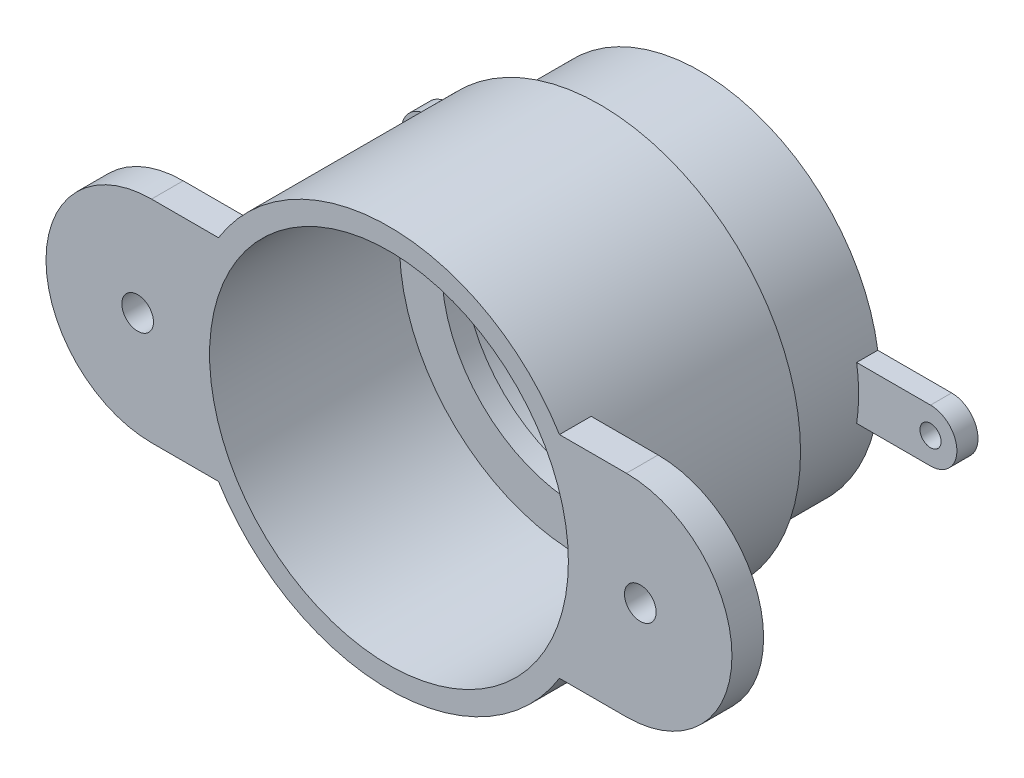
from build123d import *

# Parameters (mm, degrees)
SKETCH_1_R          = 19
EXTRUDE_1_DEPTH     = 20
EXTRUDE_2_DEPTH     = 3
SKETCH_6_R          = 17
CUT_EXTRUDE_1_DEPTH = 18
SKETCH_7_R          = 17
SKETCH_7_R_2        = 15
EXTRUDE_3_DEPTH     = 9.5
CUT_EXTRUDE_2_REACH = 44.629
SKETCH_8_R          = 13
EXTRUDE_START       = -2
EXTRUDE_4_DEPTH     = 2
CUT_EXTRUDE_3_REACH = 49.828
SKETCH_14_R         = 1
CUT_EXTRUDE_4_REACH = 48.038
SKETCH_15_R         = 1.5


with BuildPart() as part:
    # 草图1 → 凸台-拉伸1 (new body)
    with BuildSketch(Plane.XY):
        Circle(SKETCH_1_R)
    extrude(amount=EXTRUDE_1_DEPTH)

    # 草图3 → 凸台-拉伸2 (add)
    with BuildSketch(Plane.XY.offset(20)):
        with BuildLine():
            Line((-22.5, 10), (22.5, 10))
            ThreePointArc((22.5, 10), (32.5, 0), (22.5, -10))
            Line((22.5, -10), (-22.5, -10))
            ThreePointArc((-22.5, -10), (-32.5, 0), (-22.5, 10))
        make_face()
    extrude(amount=-EXTRUDE_2_DEPTH)

    # 草图6 → 切除-拉伸1 (cut)
    with BuildSketch(Plane.XY.offset(20)):
        Circle(SKETCH_6_R)
    extrude(amount=-CUT_EXTRUDE_1_DEPTH, mode=Mode.SUBTRACT)

    # 草图7 → 凸台-拉伸3 (add)
    with BuildSketch(Plane(origin=(0, 0, 0), x_dir=(-1, 0, 0), z_dir=(0, 0, -1))):
        with Locations(Location((0, 0, 0), (0, 0, 180))):
            Circle(SKETCH_7_R)
        Circle(SKETCH_7_R_2, mode=Mode.SUBTRACT)
    extrude(amount=EXTRUDE_3_DEPTH)

    # 草图8 → 切除-拉伸2 (cut, up to next)
    with BuildSketch(Plane(origin=(0, 0, 0), x_dir=(-1, 0, 0), z_dir=(0, 0, -1)), mode=Mode.PRIVATE) as cut_extrude_2_sk1:
        Circle(SKETCH_8_R)
    cut_extrude_2_tool1 = extrude(cut_extrude_2_sk1.sketch, amount=-CUT_EXTRUDE_2_REACH, mode=Mode.PRIVATE) & part.part
    add(cut_extrude_2_tool1.solids().sort_by_distance((0, 0, 0))[0], mode=Mode.SUBTRACT)

    # 草图10 → 凸台-拉伸4 (add)
    with BuildSketch(Plane(origin=(0, 0, -9.5), x_dir=(-1, 0, 0), z_dir=(0, 0, -1)).offset(EXTRUDE_START)):
        with BuildLine():
            Line((-16.815171721, 2.5), (-23.815171721, 2.5))
            ThreePointArc((-23.815171721, 2.5), (-26.315171721, 0), (-23.815171721, -2.5))
            Line((-23.815171721, -2.5), (-16.815171721, -2.5))
            ThreePointArc((-16.815171721, -2.5), (-17, 0), (-16.815171721, 2.5))
        make_face()
        with BuildLine():
            Line((16.815171721, 2.5), (23.815171721, 2.5))
            ThreePointArc((23.815171721, 2.5), (26.315171721, 0), (23.815171721, -2.5))
            Line((23.815171721, -2.5), (16.815171721, -2.5))
            ThreePointArc((16.815171721, -2.5), (17, 0), (16.815171721, 2.5))
        make_face()
    extrude(amount=EXTRUDE_4_DEPTH)

    # 草图14 → 切除-拉伸3 (cut, up to next)
    with BuildSketch(Plane(origin=(0, 0, -9.5), x_dir=(-1, 0, 0), z_dir=(0, 0, -1)), mode=Mode.PRIVATE) as cut_extrude_3_sk1:
        with Locations((-23.815171721, 0)):
            Circle(SKETCH_14_R)
    cut_extrude_3_tool1 = extrude(cut_extrude_3_sk1.sketch, amount=-CUT_EXTRUDE_3_REACH, mode=Mode.PRIVATE) & part.part
    cut_extrude_3 = cut_extrude_3_tool1.solids().sort_by_distance((23.815172, 0, -9.5))[0]
    add(cut_extrude_3, mode=Mode.SUBTRACT)

    # 草图15 → 切除-拉伸4 (cut, up to next)
    with BuildSketch(Plane(origin=(0, 0, 17), x_dir=(-1, 0, 0), z_dir=(0, 0, -1)), mode=Mode.PRIVATE) as cut_extrude_4_sk1:
        with Locations((-23.815171721, 0)):
            Circle(SKETCH_15_R)
    cut_extrude_4_tool1 = extrude(cut_extrude_4_sk1.sketch, amount=-CUT_EXTRUDE_4_REACH, mode=Mode.PRIVATE) & part.part
    cut_extrude_4 = cut_extrude_4_tool1.solids().sort_by_distance((23.815172, 0, 17))[0]
    add(cut_extrude_4, mode=Mode.SUBTRACT)

    # 镜向1: 切除-拉伸3, 切除-拉伸4 across plane
    add(cut_extrude_3.mirror(Plane(origin=(0, 0, 0), x_dir=(0, 0, 1), z_dir=(1, 0, 0))), mode=Mode.SUBTRACT)
    add(cut_extrude_4.mirror(Plane(origin=(0, 0, 0), x_dir=(0, 0, 1), z_dir=(1, 0, 0))), mode=Mode.SUBTRACT)


solid = part.part
